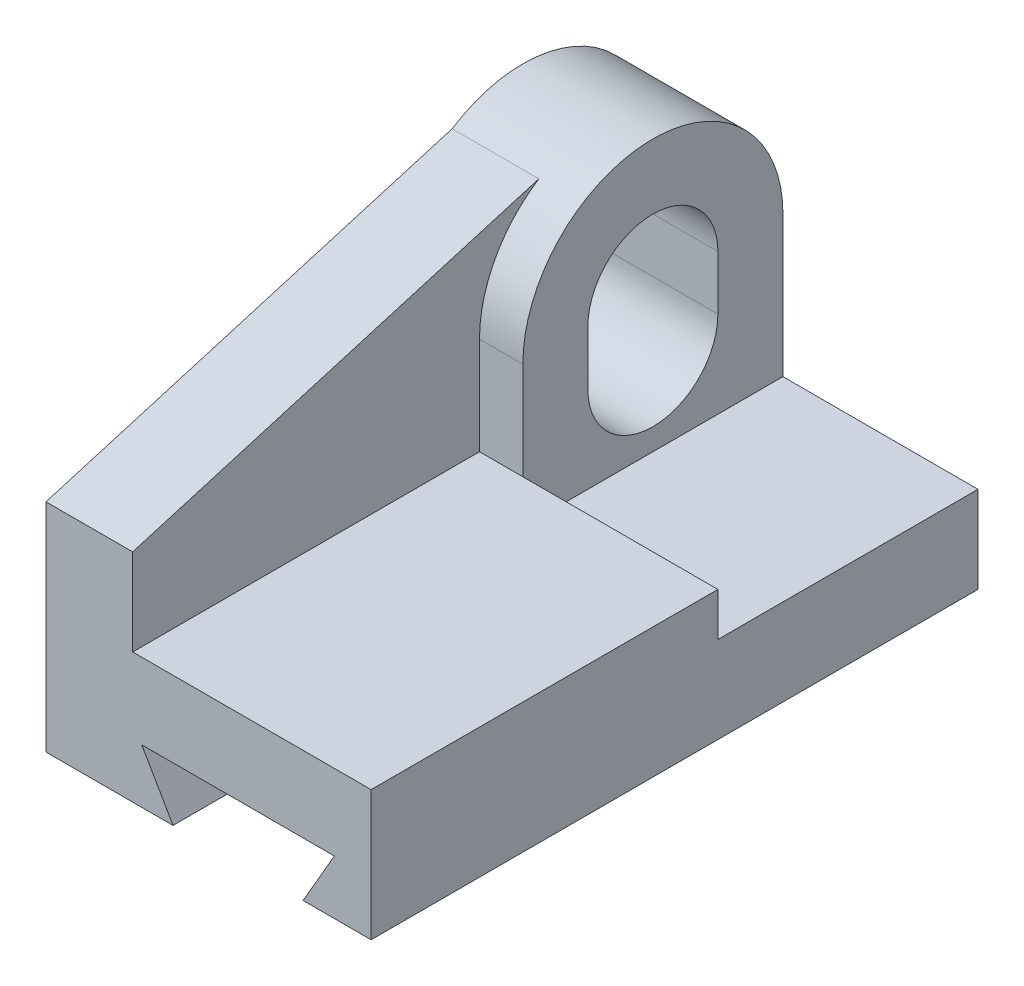
from build123d import *

# Parameters (mm, degrees)
SKETCH_1_W          = 24
SKETCH_1_H          = 8
EXTRUDE_4_DEPTH     = 30
EXTRUDE_5_DEPTH     = 12
EXTRUDE_6_DEPTH     = 8
CUT_EXTRUDE_1_DEPTH = 72.589105316


with BuildPart() as part:
    # 草图1 → 凸台-拉伸4 (new body)
    with BuildSketch(Plane(origin=(0, 0, 0), x_dir=(0, 0, -1), z_dir=(1, 0, 0))):
        Polygon((32, 12), (0, 12), (0, 0), (32, 0), (32, 8), align=None)
        with Locations((44, 4)):
            Rectangle(SKETCH_1_W, SKETCH_1_H)
    extrude(amount=EXTRUDE_4_DEPTH)

    # 草图2 → 凸台-拉伸5 (add)
    with BuildSketch(Plane.ZY):
        with BuildLine():
            Line((-38, 21), (-32, 21))
            ThreePointArc((-32, 21), (-44, 33), (-56, 21))
            Line((-56, 21), (-50, 21))
            ThreePointArc((-50, 21), (-44, 27), (-38, 21))
        make_face()
        with BuildLine():
            Line((-56, 8), (-32, 8))
            Line((-32, 8), (-32, 12))
            Line((-32, 12), (-32, 21))
            Line((-32, 21), (-38, 21))
            Line((-38, 21), (-38, 16))
            ThreePointArc((-38, 16), (-44, 10), (-50, 16))
            Line((-50, 16), (-50, 21))
            Line((-50, 21), (-56, 21))
            Line((-56, 21), (-56, 8))
        make_face()
    extrude(amount=-EXTRUDE_5_DEPTH)

    # 草图3 → 凸台-拉伸6 (add)
    with BuildSketch(Plane.ZY):
        with BuildLine():
            Line((0, 20), (-37.478384798, 31.073159145))
            ThreePointArc((-37.478384798, 31.073159145), (-33.458193171, 26.733263363), (-32, 21))
            Line((-32, 21), (-32, 12))
            Line((-32, 12), (0, 12))
            Line((0, 12), (0, 20))
        make_face()
    extrude(amount=-EXTRUDE_6_DEPTH)

    # 草图4 → 切除-拉伸1 (cut, through all)
    with BuildSketch(Plane.XY):
        Polygon((17.720789048, 0), (11.720789048, 0), (8.834037702, 5), (26.607540394, 5), (23.720789048, 0), align=None)
    extrude(amount=-CUT_EXTRUDE_1_DEPTH, mode=Mode.SUBTRACT)


solid = part.part
